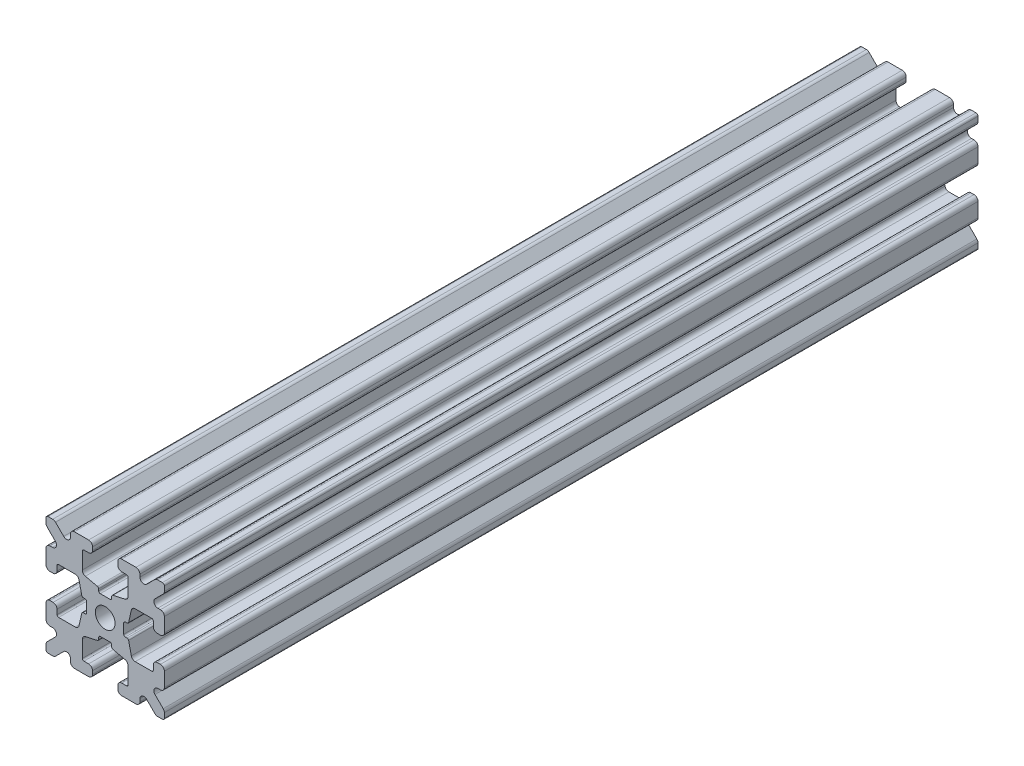
from build123d import *

# Parameters (mm, degrees)
SKETCH1_R           = 1.25
BOSS_EXTRUDE1_DEPTH = 103.1113


with BuildPart() as part:
    # Sketch1 → Boss-Extrude1 (new body)
    with BuildSketch(Plane.XY.offset(150)):
        with BuildLine():
            Line((0.981757709, -2.970049142), (2.509355729, -3.312441801))
            ThreePointArc((2.509355729, -3.312441801), (2.790306204, -3.487828881), (2.900000001, -3.80033659))
            Line((2.900000001, -3.80033659), (2.900000001, -5.9))
            ThreePointArc((2.900000001, -5.9), (2.841421357, -6.041421356), (2.700000001, -6.1))
            Line((2.700000001, -6.1), (2.1, -6.1))
            ThreePointArc((2.1, -6.1), (1.746446609, -6.246446609), (1.6, -6.6))
            Line((1.6, -6.6), (1.6, -7))
            ThreePointArc((1.6, -7), (1.746446609, -7.353553391), (2.1, -7.5))
            Line((2.1, -7.5), (3.9, -7.5))
            ThreePointArc((3.9, -7.5), (4.253553391, -7.353553391), (4.4, -7))
            Line((4.4, -7), (4.4, -6.667766953))
            ThreePointArc((4.4, -6.667766953), (4.708658284, -6.205827187), (5.253553391, -6.314213563))
            Line((5.253553391, -6.314213563), (6.292893218, -7.353553391))
            ThreePointArc((6.292893218, -7.353553391), (6.455104893, -7.461939766), (6.646446609, -7.5))
            Line((6.646446609, -7.5), (7.25, -7.5))
            ThreePointArc((7.25, -7.5), (7.426776695, -7.426776695), (7.5, -7.25))
            Line((7.5, -7.25), (7.5, -6.646446609))
            ThreePointArc((7.5, -6.646446609), (7.461939766, -6.455104893), (7.353553391, -6.292893218))
            Line((7.353553391, -6.292893218), (6.314213563, -5.253553391))
            ThreePointArc((6.314213563, -5.253553391), (6.205827187, -4.708658284), (6.667766953, -4.4))
            Line((6.667766953, -4.4), (7, -4.4))
            ThreePointArc((7, -4.4), (7.353553391, -4.253553391), (7.5, -3.9))
            Line((7.5, -3.9), (7.5, -2.1))
            ThreePointArc((7.5, -2.1), (7.353553391, -1.746446609), (7, -1.6))
            Line((7, -1.6), (6.6, -1.6))
            ThreePointArc((6.6, -1.6), (6.246446609, -1.746446609), (6.1, -2.1))
            Line((6.1, -2.1), (6.1, -2.7))
            ThreePointArc((6.1, -2.7), (6.041421356, -2.841421356), (5.9, -2.9))
            Line((5.9, -2.9), (3.800336589, -2.9))
            ThreePointArc((3.800336589, -2.9), (3.487828881, -2.790306203), (3.312441801, -2.509355728))
            Line((3.312441801, -2.509355728), (2.970049141, -0.981757708))
            ThreePointArc((2.970049141, -0.981757708), (2.899894309, -0.869377518), (2.774891226, -0.8255))
            Line((2.774891226, -0.8255), (2.5470646, -0.8255))
            ThreePointArc((2.5470646, -0.8255), (2.405643243, -0.766921356), (2.3470646, -0.6255))
            Line((2.3470646, -0.6255), (2.3470646, 0.6255))
            ThreePointArc((2.3470646, 0.6255), (2.405643243, 0.766921356), (2.5470646, 0.8255))
            Line((2.5470646, 0.8255), (2.774891226, 0.8255))
            ThreePointArc((2.774891226, 0.8255), (2.899894309, 0.869377518), (2.970049141, 0.981757708))
            Line((2.970049141, 0.981757708), (3.312441801, 2.509355728))
            ThreePointArc((3.312441801, 2.509355728), (3.487828881, 2.790306203), (3.800336589, 2.9))
            Line((3.800336589, 2.9), (5.9, 2.9))
            ThreePointArc((5.9, 2.9), (6.041421356, 2.841421356), (6.1, 2.7))
            Line((6.1, 2.7), (6.1, 2.1))
            ThreePointArc((6.1, 2.1), (6.246446609, 1.746446609), (6.6, 1.6))
            Line((6.6, 1.6), (7, 1.6))
            ThreePointArc((7, 1.6), (7.353553391, 1.746446609), (7.5, 2.1))
            Line((7.5, 2.1), (7.5, 3.9))
            ThreePointArc((7.5, 3.9), (7.353553391, 4.253553391), (7, 4.4))
            Line((7, 4.4), (6.667766953, 4.4))
            ThreePointArc((6.667766953, 4.4), (6.205827187, 4.708658284), (6.314213563, 5.253553391))
            Line((6.314213563, 5.253553391), (7.353553391, 6.292893218))
            ThreePointArc((7.353553391, 6.292893218), (7.461939766, 6.455104893), (7.5, 6.646446609))
            Line((7.5, 6.646446609), (7.5, 7.25))
            ThreePointArc((7.5, 7.25), (7.426776695, 7.426776695), (7.25, 7.5))
            Line((7.25, 7.5), (6.646446609, 7.5))
            ThreePointArc((6.646446609, 7.5), (6.455104893, 7.461939766), (6.292893218, 7.353553391))
            Line((6.292893218, 7.353553391), (5.253553391, 6.314213563))
            ThreePointArc((5.253553391, 6.314213563), (4.708658284, 6.205827187), (4.4, 6.667766954))
            Line((4.4, 6.667766954), (4.4, 7))
            ThreePointArc((4.4, 7), (4.253553391, 7.353553391), (3.9, 7.5))
            Line((3.9, 7.5), (2.1, 7.5))
            ThreePointArc((2.1, 7.5), (1.746446609, 7.353553391), (1.6, 7))
            Line((1.6, 7), (1.6, 6.6))
            ThreePointArc((1.6, 6.6), (1.746446609, 6.246446609), (2.1, 6.1))
            Line((2.1, 6.1), (2.700000001, 6.1))
            ThreePointArc((2.700000001, 6.1), (2.841421357, 6.041421356), (2.900000001, 5.9))
            Line((2.900000001, 5.9), (2.900000001, 3.800336589))
            ThreePointArc((2.900000001, 3.800336589), (2.790306204, 3.487828881), (2.509355729, 3.312441801))
            Line((2.509355729, 3.312441801), (0.981757709, 2.970049141))
            ThreePointArc((0.981757709, 2.970049141), (0.869377519, 2.899894309), (0.8255, 2.774891226))
            Line((0.8255, 2.774891226), (0.8255, 2.5470646))
            ThreePointArc((0.8255, 2.5470646), (0.766921357, 2.405643243), (0.6255, 2.3470646))
            Line((0.6255, 2.3470646), (-0.6255, 2.3470646))
            ThreePointArc((-0.6255, 2.3470646), (-0.766921356, 2.405643243), (-0.8255, 2.5470646))
            Line((-0.8255, 2.5470646), (-0.8255, 2.774891226))
            ThreePointArc((-0.8255, 2.774891226), (-0.869377518, 2.89989431), (-0.981757708, 2.970049142))
            Line((-0.981757708, 2.970049142), (-2.509355728, 3.312441801))
            ThreePointArc((-2.509355728, 3.312441801), (-2.790306203, 3.487828881), (-2.9, 3.80033659))
            Line((-2.9, 3.80033659), (-2.9, 5.9))
            ThreePointArc((-2.9, 5.9), (-2.841421356, 6.041421356), (-2.7, 6.1))
            Line((-2.7, 6.1), (-2.1, 6.1))
            ThreePointArc((-2.1, 6.1), (-1.746446609, 6.246446609), (-1.6, 6.6))
            Line((-1.6, 6.6), (-1.6, 7))
            ThreePointArc((-1.6, 7), (-1.746446609, 7.353553391), (-2.1, 7.5))
            Line((-2.1, 7.5), (-3.9, 7.5))
            ThreePointArc((-3.9, 7.5), (-4.25355339, 7.353553391), (-4.4, 7))
            Line((-4.4, 7), (-4.4, 6.667766953))
            ThreePointArc((-4.4, 6.667766953), (-4.708658283, 6.205827187), (-5.25355339, 6.314213563))
            Line((-5.25355339, 6.314213563), (-6.292893218, 7.353553391))
            ThreePointArc((-6.292893218, 7.353553391), (-6.455104893, 7.461939766), (-6.646446609, 7.5))
            Line((-6.646446609, 7.5), (-7.25, 7.5))
            ThreePointArc((-7.25, 7.5), (-7.426776695, 7.426776695), (-7.5, 7.25))
            Line((-7.5, 7.25), (-7.5, 6.646446609))
            ThreePointArc((-7.5, 6.646446609), (-7.461939766, 6.455104893), (-7.353553391, 6.292893218))
            Line((-7.353553391, 6.292893218), (-6.314213563, 5.253553391))
            ThreePointArc((-6.314213563, 5.253553391), (-6.205827187, 4.708658284), (-6.667766953, 4.4))
            Line((-6.667766953, 4.4), (-7, 4.4))
            ThreePointArc((-7, 4.4), (-7.353553391, 4.253553391), (-7.5, 3.9))
            Line((-7.5, 3.9), (-7.5, 2.1))
            ThreePointArc((-7.5, 2.1), (-7.353553391, 1.746446609), (-7, 1.6))
            Line((-7, 1.6), (-6.6, 1.6))
            ThreePointArc((-6.6, 1.6), (-6.246446609, 1.746446609), (-6.1, 2.1))
            Line((-6.1, 2.1), (-6.1, 2.7))
            ThreePointArc((-6.1, 2.7), (-6.041421356, 2.841421356), (-5.9, 2.9))
            Line((-5.9, 2.9), (-3.80033659, 2.9))
            ThreePointArc((-3.80033659, 2.9), (-3.487828881, 2.790306203), (-3.312441801, 2.509355728))
            Line((-3.312441801, 2.509355728), (-2.970049142, 0.981757708))
            ThreePointArc((-2.970049142, 0.981757708), (-2.89989431, 0.869377518), (-2.774891226, 0.8255))
            Line((-2.774891226, 0.8255), (-2.5470646, 0.8255))
            ThreePointArc((-2.5470646, 0.8255), (-2.405643244, 0.766921356), (-2.3470646, 0.6255))
            Line((-2.3470646, 0.6255), (-2.3470646, -0.6255))
            ThreePointArc((-2.3470646, -0.6255), (-2.405643244, -0.766921356), (-2.5470646, -0.8255))
            Line((-2.5470646, -0.8255), (-2.774891226, -0.8255))
            ThreePointArc((-2.774891226, -0.8255), (-2.89989431, -0.869377518), (-2.970049142, -0.981757708))
            Line((-2.970049142, -0.981757708), (-3.312441801, -2.509355728))
            ThreePointArc((-3.312441801, -2.509355728), (-3.487828881, -2.790306203), (-3.80033659, -2.9))
            Line((-3.80033659, -2.9), (-5.9, -2.9))
            ThreePointArc((-5.9, -2.9), (-6.041421356, -2.841421356), (-6.1, -2.7))
            Line((-6.1, -2.7), (-6.1, -2.1))
            ThreePointArc((-6.1, -2.1), (-6.246446609, -1.746446609), (-6.6, -1.6))
            Line((-6.6, -1.6), (-7, -1.6))
            ThreePointArc((-7, -1.6), (-7.353553391, -1.746446609), (-7.5, -2.1))
            Line((-7.5, -2.1), (-7.5, -3.9))
            ThreePointArc((-7.5, -3.9), (-7.353553391, -4.253553391), (-7, -4.4))
            Line((-7, -4.4), (-6.667766953, -4.4))
            ThreePointArc((-6.667766953, -4.4), (-6.205827187, -4.708658284), (-6.314213563, -5.253553391))
            Line((-6.314213563, -5.253553391), (-7.353553391, -6.292893218))
            ThreePointArc((-7.353553391, -6.292893218), (-7.461939766, -6.455104893), (-7.5, -6.646446609))
            Line((-7.5, -6.646446609), (-7.5, -7.25))
            ThreePointArc((-7.5, -7.25), (-7.426776695, -7.426776695), (-7.25, -7.5))
            Line((-7.25, -7.5), (-6.646446609, -7.5))
            ThreePointArc((-6.646446609, -7.5), (-6.455104893, -7.461939766), (-6.292893218, -7.353553391))
            Line((-6.292893218, -7.353553391), (-5.25355339, -6.314213563))
            ThreePointArc((-5.25355339, -6.314213563), (-4.708658284, -6.205827187), (-4.4, -6.667766953))
            Line((-4.4, -6.667766953), (-4.4, -7))
            ThreePointArc((-4.4, -7), (-4.25355339, -7.353553391), (-3.9, -7.5))
            Line((-3.9, -7.5), (-2.1, -7.5))
            ThreePointArc((-2.1, -7.5), (-1.746446609, -7.353553391), (-1.6, -7))
            Line((-1.6, -7), (-1.6, -6.6))
            ThreePointArc((-1.6, -6.6), (-1.746446609, -6.246446609), (-2.1, -6.1))
            Line((-2.1, -6.1), (-2.7, -6.1))
            ThreePointArc((-2.7, -6.1), (-2.841421356, -6.041421356), (-2.9, -5.9))
            Line((-2.9, -5.9), (-2.9, -3.80033659))
            ThreePointArc((-2.9, -3.80033659), (-2.790306203, -3.487828881), (-2.509355728, -3.312441801))
            Line((-2.509355728, -3.312441801), (-0.981757708, -2.970049142))
            ThreePointArc((-0.981757708, -2.970049142), (-0.869377518, -2.89989431), (-0.8255, -2.774891226))
            Line((-0.8255, -2.774891226), (-0.8255, -2.5470646))
            ThreePointArc((-0.8255, -2.5470646), (-0.766921356, -2.405643244), (-0.6255, -2.3470646))
            Line((-0.6255, -2.3470646), (0.6255, -2.3470646))
            ThreePointArc((0.6255, -2.3470646), (0.766921357, -2.405643244), (0.8255, -2.5470646))
            Line((0.8255, -2.5470646), (0.8255, -2.774891226))
            ThreePointArc((0.8255, -2.774891226), (0.869377519, -2.89989431), (0.981757709, -2.970049142))
        make_face()
        with Locations(Location((0, 0, 0), (0, 0, 180))):
            Circle(SKETCH1_R, mode=Mode.SUBTRACT)
    extrude(amount=-BOSS_EXTRUDE1_DEPTH)


solid = part.part
